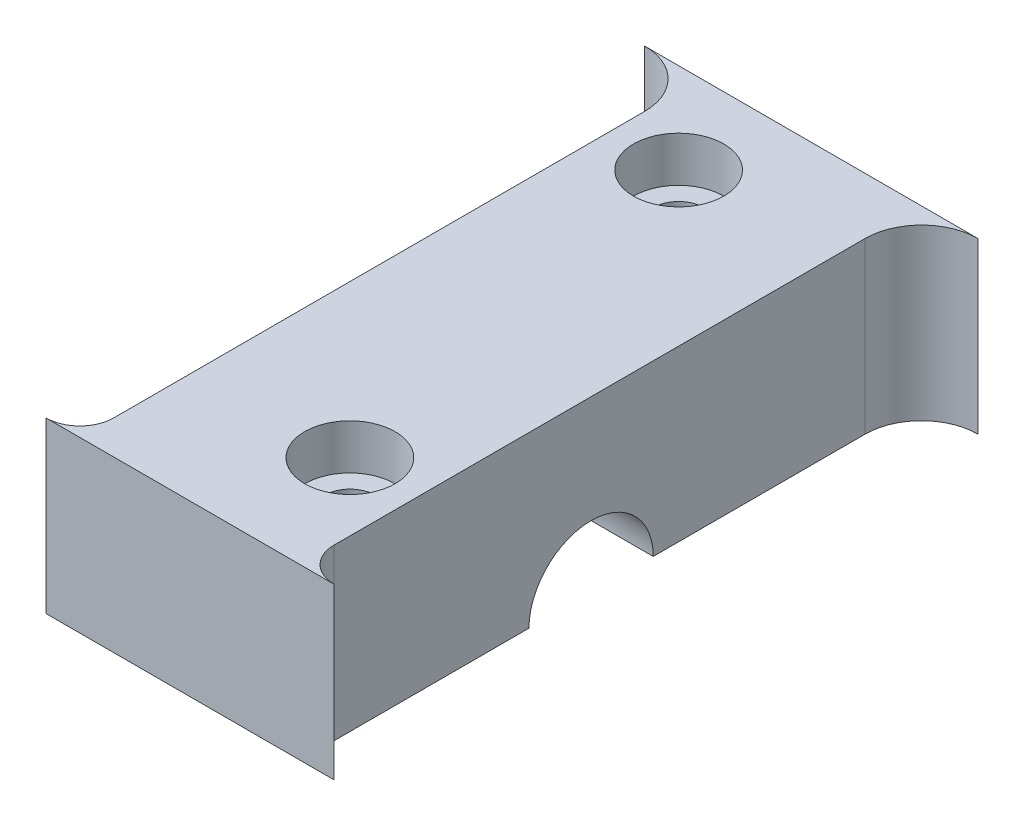
from build123d import *

# Parameters (mm, degrees)
CORPO_DEPTH                            = 15
ENCAIXE_FLANGE_11_PASSANTE_DEPTH       = 59.88601277
ENCAIXE_FLANGE_11_PASSANTE_DEPTH_BACK  = 59.88601277
ESBO_O3_R                              = 5.5
ENCAIXE_FLANGE_23X4_DEPTH              = 2
ENCAIXE_FLANGE_23X4_DEPTH_BACK         = 2
ESBO_O4_R                              = 11.5
REBAIXO_M4_FUROS_DE_FIXA_O_D           = 4.5
REBAIXO_M4_FUROS_DE_FIXA_O_CBORE_D     = 8
REBAIXO_M4_FUROS_DE_FIXA_O_CBORE_DEPTH = 4


with BuildPart() as part:
    # Esboço1 → Corpo (new body)
    with BuildSketch(Plane(origin=(0, 0, 0), x_dir=(1, 0, 0), z_dir=(0, 1, 0))):
        with BuildLine():
            Line((3, 50), (3, 3))
            ThreePointArc((3, 3), (2.121320344, 0.878679656), (0, 0))
            Line((0, 0), (25.5, 0))
            ThreePointArc((25.5, 0), (23.378679656, 0.878679656), (22.5, 3))
            Line((22.5, 3), (22.5, 50))
            ThreePointArc((22.5, 50), (23.964466094, 53.535533906), (27.5, 55))
            Line((27.5, 55), (-2, 55))
            ThreePointArc((-2, 55), (1.535533906, 53.535533906), (3, 50))
        make_face()
    extrude(amount=CORPO_DEPTH)

    # Esboço3 → Encaixe Flange - Ø11 Passante (cut, two sides: drawn at the far end of the back side and taken through both)
    with BuildSketch(Plane(origin=(12.75, 0, 0), x_dir=(0, 0, -1), z_dir=(1, 0, 0)).offset(-ENCAIXE_FLANGE_11_PASSANTE_DEPTH_BACK)):
        with Locations((25.75, 0)):
            Circle(ESBO_O3_R)
    extrude(amount=ENCAIXE_FLANGE_11_PASSANTE_DEPTH + ENCAIXE_FLANGE_11_PASSANTE_DEPTH_BACK, mode=Mode.SUBTRACT)

    # Esboço4 → Encaixe Flange - Ø23x4 (cut, two sides: drawn at the far end of the back side and taken through both)
    with BuildSketch(Plane(origin=(12.75, 0, 0), x_dir=(0, 0, -1), z_dir=(1, 0, 0)).offset(-ENCAIXE_FLANGE_23X4_DEPTH_BACK)):
        with Locations((25.75, 0)):
            Circle(ESBO_O4_R)
    extrude(amount=ENCAIXE_FLANGE_23X4_DEPTH + ENCAIXE_FLANGE_23X4_DEPTH_BACK, mode=Mode.SUBTRACT)

    # Rebaixo M4 - Furos de Fixação (through all)
    with Locations(Plane(origin=(0, 15, 0), x_dir=(1, 0, 0), z_dir=(0, 1, 0))):
        with Locations((16.5, 10.4), (9, 47)):
            CounterBoreHole(REBAIXO_M4_FUROS_DE_FIXA_O_D / 2, REBAIXO_M4_FUROS_DE_FIXA_O_CBORE_D / 2, REBAIXO_M4_FUROS_DE_FIXA_O_CBORE_DEPTH)


solid = part.part
